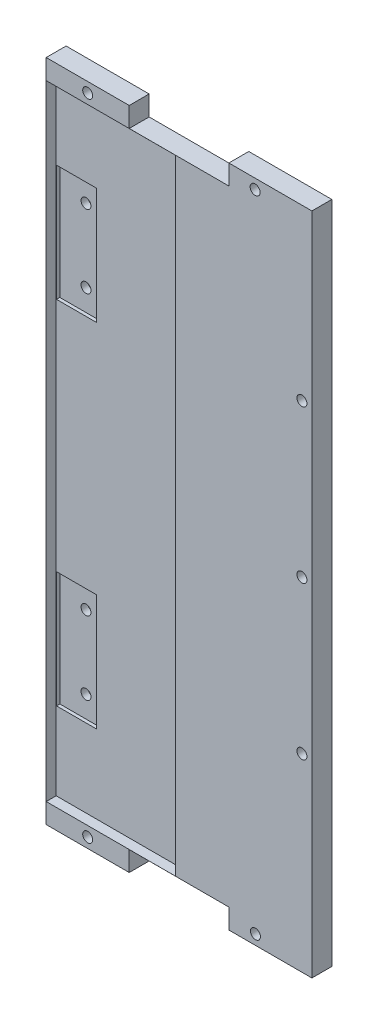
from build123d import *

# Parameters (mm, degrees)
ESQUISSE1_W             = 80
ESQUISSE1_H             = 200
BOSS_EXTRU_1_DEPTH      = 6
ESQUISSE4_W             = 39
ESQUISSE4_H             = 187.98
ENL_V_MAT_EXTRU_3_DEPTH = 3
ESQUISSE5_W             = 30
ESQUISSE5_H             = 6
ENL_V_MAT_EXTRU_4_DEPTH = 10
ESQUISSE6_R             = 2.995
ENL_V_MAT_EXTRU_5_DEPTH = 3
ESQUISSE7_R             = 1.5
ENL_V_MAT_EXTRU_6_DEPTH = 13
ESQUISSE8_R             = 1.5
ENL_V_MAT_EXTRU_7_DEPTH = 10
ESQUISSE9_R             = 1.5
ENL_V_MAT_EXTRU_8_DEPTH = 10
ESQUISSE10_W            = 12
ESQUISSE10_H            = 35
ENL_V_MAT_EXTRU_9_DEPTH = 1


with BuildPart() as part:
    # Esquisse1 → Boss.-Extru.1 (new body)
    with BuildSketch(Plane.XY):
        Rectangle(ESQUISSE1_W, ESQUISSE1_H)
    extrude(amount=BOSS_EXTRU_1_DEPTH)

    # Esquisse4 → Enlèv. mat.-Extru.3 (cut)
    with BuildSketch(Plane.XY.offset(6)):
        with Locations((-20.49, 0)):
            Rectangle(ESQUISSE4_W, ESQUISSE4_H)
    extrude(amount=-ENL_V_MAT_EXTRU_3_DEPTH, mode=Mode.SUBTRACT)

    # Esquisse5 → Enlèv. mat.-Extru.4 (cut)
    with BuildSketch(Plane.XY.offset(6)):
        with Locations((0, 97)):
            Rectangle(ESQUISSE5_W, ESQUISSE5_H)
        with Locations((0, -97)):
            Rectangle(ESQUISSE5_W, ESQUISSE5_H)
    extrude(amount=-ENL_V_MAT_EXTRU_4_DEPTH, mode=Mode.SUBTRACT)

    # Esquisse6 → Enlèv. mat.-Extru.5 (cut)
    with BuildSketch(Plane(origin=(0, 0, 0), x_dir=(-1, 0, 0), z_dir=(0, 0, -1))):
        with Locations((27.5, -97)):
            Circle(ESQUISSE6_R)
        with Locations((-23, -97)):
            Circle(ESQUISSE6_R)
        with Locations((27.5, 97)):
            Circle(ESQUISSE6_R)
        with Locations((-23, 97)):
            Circle(ESQUISSE6_R)
    extrude(amount=-ENL_V_MAT_EXTRU_5_DEPTH, mode=Mode.SUBTRACT)

    # Esquisse7 → Enlèv. mat.-Extru.6 (cut)
    with BuildSketch(Plane(origin=(0, 0, 0), x_dir=(-1, 0, 0), z_dir=(0, 0, -1))):
        with Locations((27.5, 97)):
            Circle(ESQUISSE7_R)
        with Locations((-22.909579605, 97)):
            Circle(ESQUISSE7_R)
        with Locations((27.5, -97)):
            Circle(ESQUISSE7_R)
        with Locations((-23, -97)):
            Circle(ESQUISSE7_R)
    extrude(amount=-ENL_V_MAT_EXTRU_6_DEPTH, mode=Mode.SUBTRACT)

    # Esquisse8 → Enlèv. mat.-Extru.7 (cut)
    with BuildSketch(Plane.XY.offset(3)):
        with Locations((-32.01, 64)):
            Circle(ESQUISSE8_R)
        with Locations((-32.01, 42)):
            Circle(ESQUISSE8_R)
        with Locations((-32.01, -42)):
            Circle(ESQUISSE8_R)
        with Locations((-32.01, -64)):
            Circle(ESQUISSE8_R)
    extrude(amount=-ENL_V_MAT_EXTRU_7_DEPTH, mode=Mode.SUBTRACT)

    # Esquisse9 → Enlèv. mat.-Extru.8 (cut)
    with BuildSketch(Plane(origin=(0, 0, 0), x_dir=(-1, 0, 0), z_dir=(0, 0, -1))):
        with Locations((-37, -43)):
            Circle(ESQUISSE9_R)
        with Locations((-37, 3)):
            Circle(ESQUISSE9_R)
        with Locations((-37, 49)):
            Circle(ESQUISSE9_R)
    extrude(amount=-ENL_V_MAT_EXTRU_8_DEPTH, mode=Mode.SUBTRACT)

    # Esquisse10 → Enlèv. mat.-Extru.9 (cut)
    with BuildSketch(Plane.XY.offset(3)):
        with Locations((-33.9, 53)):
            Rectangle(ESQUISSE10_W, ESQUISSE10_H)
        with Locations((-33.9, -53)):
            Rectangle(ESQUISSE10_W, ESQUISSE10_H)
    extrude(amount=-ENL_V_MAT_EXTRU_9_DEPTH, mode=Mode.SUBTRACT)


solid = part.part
